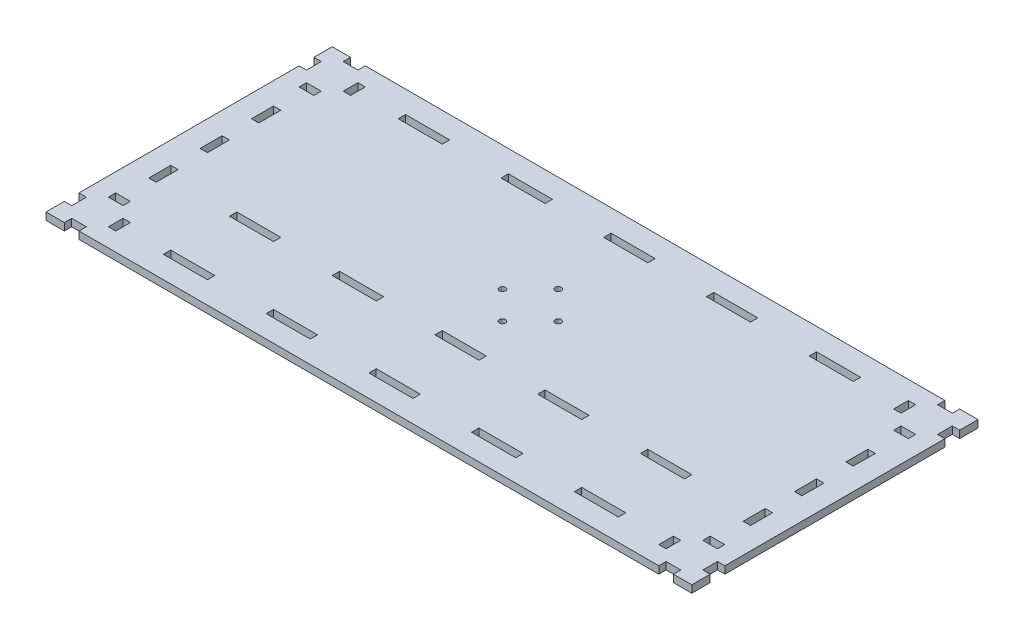
from build123d import *

# Parameters (mm, degrees)
SKETCH2_R           = 2.1
SKETCH2_W           = 30
SKETCH2_H           = 5
SKETCH2_W_2         = 10
SKETCH2_W_3         = 4.999728605
SKETCH2_H_2         = 10
SKETCH2_W_4         = 5
SKETCH2_H_3         = 15
BOSS_EXTRUDE1_DEPTH = 5


with BuildPart() as part:
    # Sketch2 → Boss-Extrude1 (new body)
    with BuildSketch(Plane(origin=(0, -435, 0), x_dir=(1, 0, 0), z_dir=(0, 1, 0))):
        Polygon((-17.5, -95), (-17.5, -100), (-5, -100), (-5, -87.5), (-10, -87.5), (-10, -77.5), (-5, -77.5), (-5, 72.5), (-10, 72.5), (-10, 82.5), (-5, 82.5), (-5, 95), (-17.5, 95), (-17.5, 90), (-27.5, 90), (-27.5, 95), (-422.5, 95), (-422.5, 90), (-432.5, 90), (-432.5, 95), (-445, 95), (-445, 82.5), (-440, 82.5), (-440, 72.5), (-445, 72.5), (-445, -77.5), (-440, -77.5), (-440, -87.5), (-445, -87.5), (-445, -100), (-432.5, -100), (-432.5, -95), (-422.5, -95), (-422.5, -100), (-27.5, -100), (-27.5, -95), align=None)
        with Locations(Location((-225, -9, 0), (0, 0, 270))):
            Circle(SKETCH2_R, mode=Mode.SUBTRACT)
        with Locations(Location((-225, 29, 0), (0, 0, 90))):
            Circle(SKETCH2_R, mode=Mode.SUBTRACT)
        with Locations(Location((-206, 10, 0), (0, 0, 270))):
            Circle(SKETCH2_R, mode=Mode.SUBTRACT)
        with Locations(Location((-244, 10, 0), (0, 0, 90))):
            Circle(SKETCH2_R, mode=Mode.SUBTRACT)
        with Locations((-85, -82.5)):
            Rectangle(SKETCH2_W, SKETCH2_H, mode=Mode.SUBTRACT)
        with Locations((-155, -82.5)):
            Rectangle(SKETCH2_W, SKETCH2_H, mode=Mode.SUBTRACT)
        with Locations((-22.5, 62.5)):
            Rectangle(SKETCH2_W_2, SKETCH2_H, mode=Mode.SUBTRACT)
        with Locations((-225, -82.5)):
            Rectangle(SKETCH2_W, SKETCH2_H, mode=Mode.SUBTRACT)
        with Locations((-37.500135697, 77.5)):
            Rectangle(SKETCH2_W_3, SKETCH2_H_2, mode=Mode.SUBTRACT)
        with Locations((-427.5, -37.5)):
            Rectangle(SKETCH2_W_4, SKETCH2_H_3, mode=Mode.SUBTRACT)
        with Locations((-427.5, 62.5)):
            Rectangle(SKETCH2_W_2, SKETCH2_H, mode=Mode.SUBTRACT)
        with Locations((-427.5, -2.5)):
            Rectangle(SKETCH2_W_4, SKETCH2_H_3, mode=Mode.SUBTRACT)
        with Locations((-412.499864302, 77.5)):
            Rectangle(SKETCH2_W_3, SKETCH2_H_2, mode=Mode.SUBTRACT)
        with Locations((-427.5, 32.5)):
            Rectangle(SKETCH2_W_4, SKETCH2_H_3, mode=Mode.SUBTRACT)
        with Locations((-412.499864302, -82.5)):
            Rectangle(SKETCH2_W_3, SKETCH2_H_2, mode=Mode.SUBTRACT)
        with Locations((-22.5, 32.5)):
            Rectangle(SKETCH2_W_4, SKETCH2_H_3, mode=Mode.SUBTRACT)
        with Locations((-427.5, -67.5)):
            Rectangle(SKETCH2_W_2, SKETCH2_H, mode=Mode.SUBTRACT)
        with Locations((-22.5, -2.5)):
            Rectangle(SKETCH2_W_4, SKETCH2_H_3, mode=Mode.SUBTRACT)
        with Locations((-22.5, -67.5)):
            Rectangle(SKETCH2_W_2, SKETCH2_H, mode=Mode.SUBTRACT)
        with Locations((-22.5, -37.5)):
            Rectangle(SKETCH2_W_4, SKETCH2_H_3, mode=Mode.SUBTRACT)
        with Locations((-37.500135697, -82.5)):
            Rectangle(SKETCH2_W_3, SKETCH2_H_2, mode=Mode.SUBTRACT)
        with Locations((-295, -82.5)):
            Rectangle(SKETCH2_W, SKETCH2_H, mode=Mode.SUBTRACT)
        with Locations((-365, -82.5)):
            Rectangle(SKETCH2_W, SKETCH2_H, mode=Mode.SUBTRACT)
        with Locations((-365, 77.5)):
            Rectangle(SKETCH2_W, SKETCH2_H, mode=Mode.SUBTRACT)
        with Locations((-295, 77.5)):
            Rectangle(SKETCH2_W, SKETCH2_H, mode=Mode.SUBTRACT)
        with Locations((-225, 77.5)):
            Rectangle(SKETCH2_W, SKETCH2_H, mode=Mode.SUBTRACT)
        with Locations((-155, 77.5)):
            Rectangle(SKETCH2_W, SKETCH2_H, mode=Mode.SUBTRACT)
        with Locations((-85, 77.5)):
            Rectangle(SKETCH2_W, SKETCH2_H, mode=Mode.SUBTRACT)
        with Locations((-365, -37.5)):
            Rectangle(SKETCH2_W, SKETCH2_H, mode=Mode.SUBTRACT)
        with Locations((-295, -37.5)):
            Rectangle(SKETCH2_W, SKETCH2_H, mode=Mode.SUBTRACT)
        with Locations((-225, -37.5)):
            Rectangle(SKETCH2_W, SKETCH2_H, mode=Mode.SUBTRACT)
        with Locations((-155, -37.5)):
            Rectangle(SKETCH2_W, SKETCH2_H, mode=Mode.SUBTRACT)
        with Locations((-85, -37.5)):
            Rectangle(SKETCH2_W, SKETCH2_H, mode=Mode.SUBTRACT)
    extrude(amount=BOSS_EXTRUDE1_DEPTH)


solid = part.part
